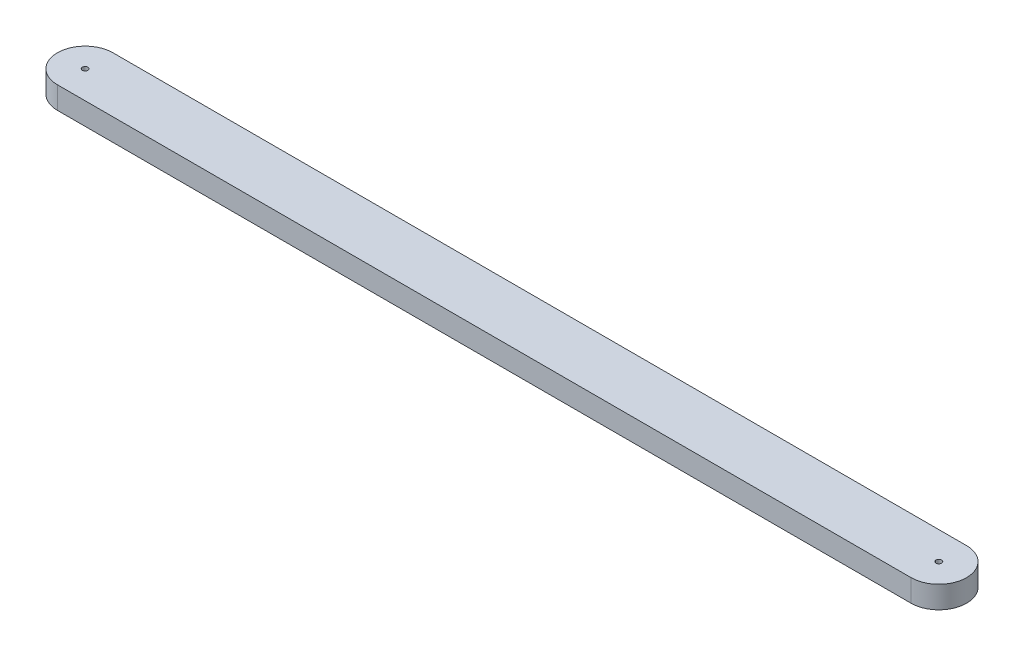
from build123d import *

# Parameters (mm, degrees)
BOSS_EXTRUDE1_DEPTH      = 2
BOSS_EXTRUDE1_DEPTH_BACK = 2
SKETCH1_R                = 0.5


with BuildPart() as part:
    # Sketch1 → Boss-Extrude1 (new, two sides: drawn at the far end of the back side and taken through both)
    with BuildSketch(Plane(origin=(0, 0, 0), x_dir=(1, 0, 0), z_dir=(0, 1, 0)).offset(-BOSS_EXTRUDE1_DEPTH_BACK)):
        with BuildLine():
            ThreePointArc((-76.94, 5), (-81.94, 0), (-76.94, -5))
            Line((-76.94, -5), (76.94, -5))
            ThreePointArc((76.94, -5), (81.94, 0), (76.94, 5))
            Line((76.94, 5), (-76.94, 5))
        make_face()
        with Locations((-76.94, 0)):
            Circle(SKETCH1_R, mode=Mode.SUBTRACT)
        with Locations((76.94, 0)):
            Circle(SKETCH1_R, mode=Mode.SUBTRACT)
    extrude(amount=BOSS_EXTRUDE1_DEPTH + BOSS_EXTRUDE1_DEPTH_BACK)


solid = part.part
